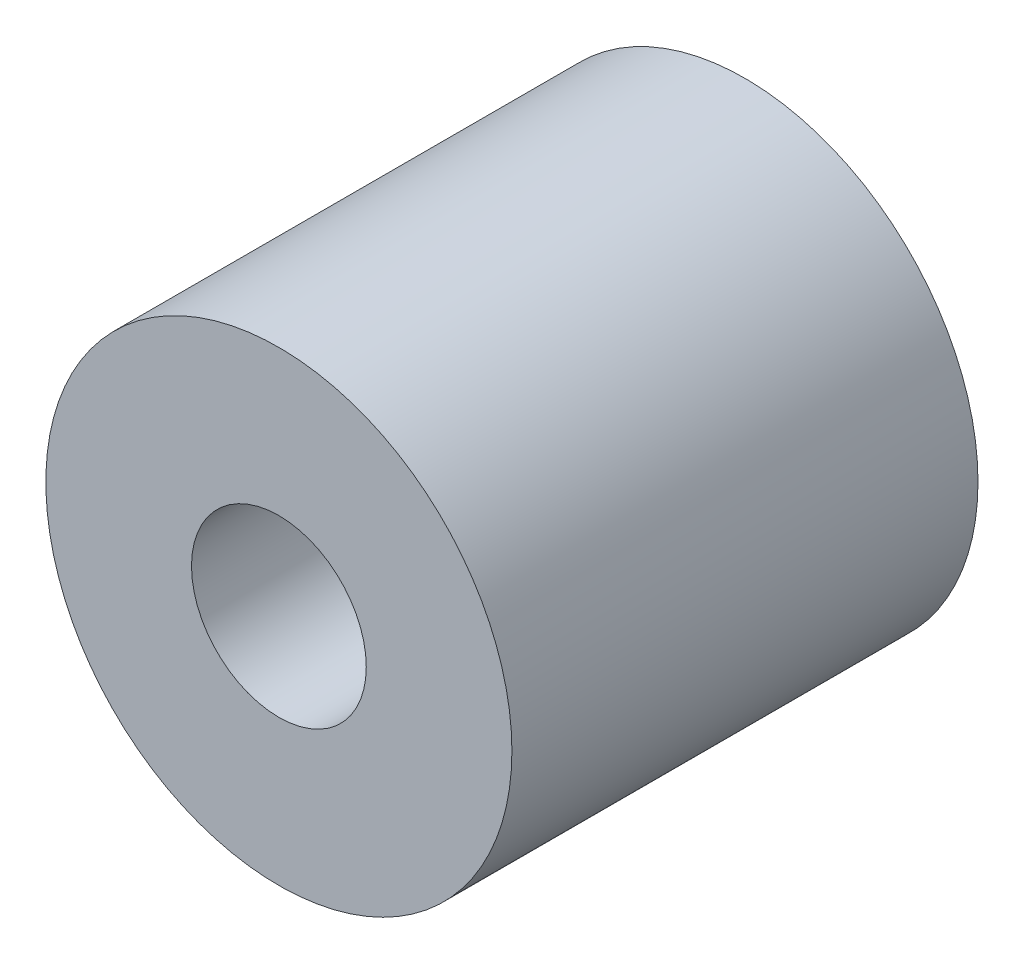
from build123d import *

# Parameters (mm, degrees)
SKETCH_1_R      = 4
SKETCH_1_R_2    = 1.5
EXTRUDE_1_DEPTH = 8


with BuildPart() as part:
    # 草图1 → 凸台-拉伸1 (new body)
    with BuildSketch(Plane.XY):
        Circle(SKETCH_1_R)
        Circle(SKETCH_1_R_2, mode=Mode.SUBTRACT)
    extrude(amount=EXTRUDE_1_DEPTH)


solid = part.part
